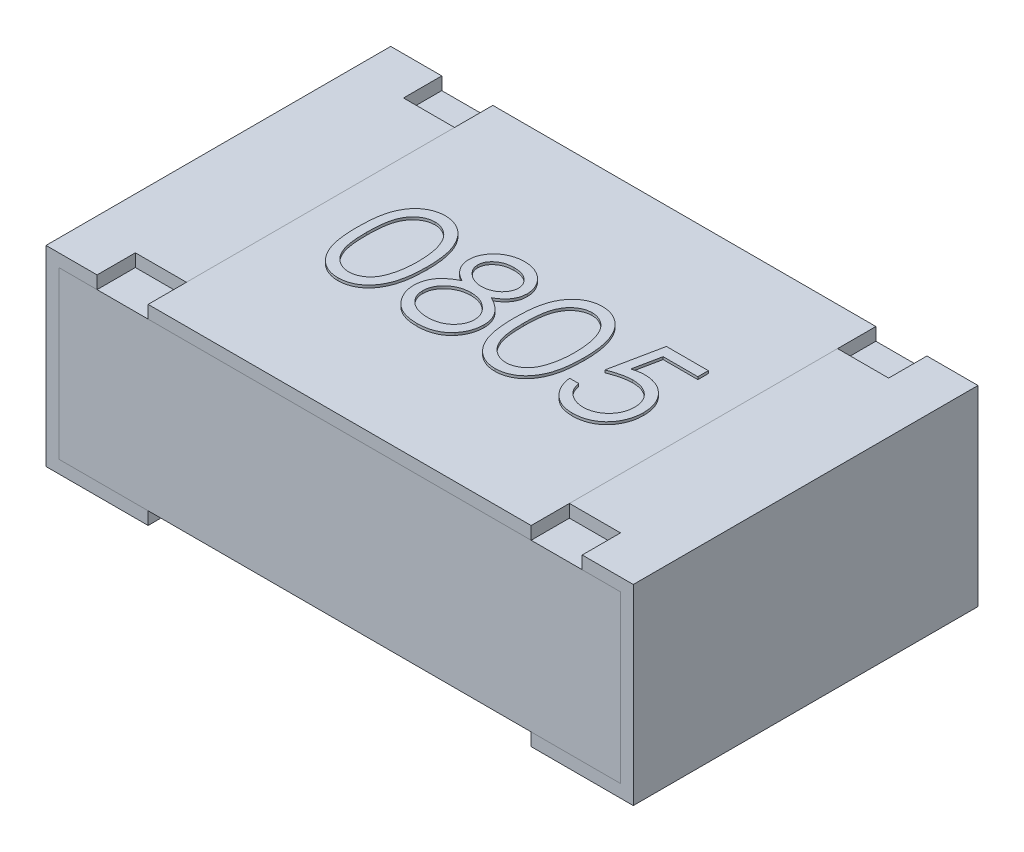
from build123d import *

# Parameters (mm, degrees)
CROQUIS1_W          = 2.2
CROQUIS1_H          = 1.35
EXTRUIR1_DEPTH      = 0.7
CROQUIS2_W          = 2.2
CROQUIS2_H          = 0.05
EXTRUIR2_DEPTH      = 2.876832438
CROQUIS4_W          = 1.35
CROQUIS4_H          = 0.05
EXTRUIR3_DEPTH      = 1.5
CROQUIS5_W          = 0.2
CROQUIS5_H          = 0.15
EXTRUIR4_DEPTH      = 0.05
BOSS_EXTRUDE1_DEPTH = 0.01


with BuildPart() as part:
    # Croquis1 → Extruir1 (new body)
    with BuildSketch(Plane(origin=(0, 0, 0), x_dir=(1, 0, 0), z_dir=(0, 1, 0))):
        Rectangle(CROQUIS1_W, CROQUIS1_H)
    extrude(amount=EXTRUIR1_DEPTH)

    # Croquis2 → Extruir2 (cut, through all)
    with BuildSketch(Plane.XY.offset(0.675)):
        with Locations((0, 0.025)):
            Rectangle(CROQUIS2_W, CROQUIS2_H)
    extrude(amount=-EXTRUIR2_DEPTH, mode=Mode.SUBTRACT)


with BuildPart() as body_2:
    # Barrer1: sweep along a path in Croquis3
    with BuildLine(Plane.XY.offset(0.675)) as barrer1_path:
        Line((-0.75, 0.75), (-1.15, 0.75))
        Line((-1.15, 0.75), (-1.15, 0))
        Line((-1.15, 0), (-0.75, 0))
    # Croquis3D1 → Barrer1 (sweep)
    with BuildSketch(Plane(origin=(-0.75, 0.75, 0.675), x_dir=(0, -0.0370116605098802, -0.9993148337667672), z_dir=(-1, 0, 0))):
        Polygon((0, 0), (1.349075026, -0.049965742), (1.350925609, 0), (0.001850583, 0.049965742), align=None)
    sweep(path=barrer1_path.line, transition=Transition.RIGHT)


with BuildPart() as body_3:
    # Simetría1: mirrored copy
    add(body_2.part.mirror(Plane(origin=(0, 0.7, 0.675), x_dir=(0, 0, 1), z_dir=(1, 0, 0))))


with BuildPart() as body_4:
    # Croquis4 → Extruir3 (new body)
    with BuildSketch(Plane(origin=(-0.75, 0, 0), x_dir=(0, 0, -1), z_dir=(1, 0, 0))):
        with Locations((0, 0.725)):
            Rectangle(CROQUIS4_W, CROQUIS4_H)
    extrude(amount=EXTRUIR3_DEPTH)

    # Sketch1 → Boss-Extrude1 (add)
    # profile 1 of 4: a face of its own
    with BuildSketch(Plane(origin=(0, 0.75, 0), x_dir=(1, 0, 0), z_dir=(0, 1, 0))):
        with BuildLine():
            add(Edge.make_bspline(
                [(-0.59261561, -0.012986983), (-0.592578122, -0.006575853), (-0.592505301, 0.005877859), (-0.591695196, 0.024024675), (-0.590349443, 0.041048708), (-0.588505172, 0.056950773), (-0.586260831, 0.071734975), (-0.583264775, 0.085361804), (-0.579857598, 0.097894331), (-0.575908747, 0.109373422), (-0.571453, 0.119953731), (-0.56660337, 0.129830897), (-0.561167393, 0.138989975), (-0.555455746, 0.147577151), (-0.549237224, 0.155451859), (-0.542688791, 0.162725306), (-0.535554862, 0.169229392), (-0.528077947, 0.175154683), (-0.520190351, 0.180348909), (-0.512116903, 0.184924079), (-0.503802034, 0.188832635), (-0.495223042, 0.191905828), (-0.486457035, 0.19444421), (-0.47747337, 0.19618009), (-0.468257214, 0.197272308), (-0.462036479, 0.197376727), (-0.458881635, 0.197429683)],
                knots=[0, 0, 0, 0, 1.646270934, 3.197905019, 4.663502075, 6.030701355, 7.308322542, 8.50163776, 9.611534131, 10.641858119, 11.616356847, 12.558055219, 13.465016945, 14.349605745, 15.204443733, 16.039544428, 16.859896111, 17.680448484, 18.487036065, 19.28249412, 20.06191084, 20.843045899, 21.620316918, 22.403196591, 23.190181807, 24, 24, 24, 24], degree=3))
            add(Edge.make_bspline(
                [(-0.458881635, 0.197429683), (-0.455700438, 0.197373933), (-0.449374037, 0.197263063), (-0.440020851, 0.19619747), (-0.430883745, 0.194429341), (-0.422001672, 0.191924087), (-0.413301673, 0.18881601), (-0.404851798, 0.184920339), (-0.39659956, 0.180385612), (-0.388676099, 0.175057168), (-0.380994428, 0.169116337), (-0.373743233, 0.162400603), (-0.366921851, 0.154977778), (-0.360444674, 0.146927279), (-0.354495463, 0.138094698), (-0.348829927, 0.128633657), (-0.343758838, 0.118378701), (-0.338874875, 0.107500934), (-0.334659219, 0.095699372), (-0.330857363, 0.083040543), (-0.32778548, 0.069374921), (-0.325226706, 0.054774208), (-0.323244433, 0.039184781), (-0.321800702, 0.022640059), (-0.321038064, 0.005129157), (-0.320894441, -0.006843168), (-0.320820738, -0.012986983)],
                knots=[0, 0, 0, 0, 0.810914788, 1.612654377, 2.396697861, 3.181598691, 3.963628158, 4.749916497, 5.551656086, 6.361998678, 7.18212741, 8.025565596, 8.878627764, 9.750805457, 10.657531673, 11.591944965, 12.560506719, 13.57287815, 14.630710178, 15.753379473, 16.941251878, 18.199788006, 19.531962791, 20.947069417, 22.433333509, 24, 24, 24, 24], degree=3))
            add(Edge.make_bspline(
                [(-0.320820738, -0.012986983), (-0.320895205, -0.019104001), (-0.3210403, -0.031022762), (-0.321792153, -0.048454873), (-0.323273139, -0.064911792), (-0.325125709, -0.080432988), (-0.327691533, -0.094953859), (-0.33084641, -0.108524653), (-0.334349304, -0.121203975), (-0.33867328, -0.132887954), (-0.343405933, -0.143739579), (-0.348555098, -0.153872968), (-0.35407165, -0.163377687), (-0.360081792, -0.172177658), (-0.366487896, -0.180335219), (-0.373427072, -0.187706376), (-0.38070371, -0.194468738), (-0.388407986, -0.200486067), (-0.396455021, -0.205752902), (-0.404678915, -0.210463056), (-0.413225588, -0.214261078), (-0.421901354, -0.217522226), (-0.43083031, -0.220013706), (-0.440001326, -0.221736433), (-0.449367753, -0.222944644), (-0.45569936, -0.223036813), (-0.458881635, -0.223083137)],
                knots=[0, 0, 0, 0, 1.561518951, 3.042555995, 4.452378317, 5.7783523, 7.031515105, 8.214008947, 9.334062868, 10.386615937, 11.391082383, 12.354592575, 13.286541444, 14.194233754, 15.072674879, 15.931287219, 16.775624067, 17.606195743, 18.42308326, 19.229000347, 20.022332153, 20.807536673, 21.593273796, 22.3848459, 23.188221202, 24, 24, 24, 24], degree=3))
            add(Edge.make_bspline(
                [(-0.458881635, -0.223083137), (-0.462036391, -0.22302984), (-0.468256954, -0.222924747), (-0.477474374, -0.221837463), (-0.486420939, -0.220089406), (-0.495140797, -0.217641794), (-0.503678684, -0.214645812), (-0.51191826, -0.210742534), (-0.519951138, -0.206247212), (-0.527755887, -0.201127735), (-0.535185849, -0.1952624), (-0.542282832, -0.188775053), (-0.548868548, -0.181503806), (-0.554998159, -0.173563472), (-0.560823769, -0.165027101), (-0.566182555, -0.155778144), (-0.571139224, -0.145853275), (-0.575669909, -0.135188371), (-0.579686899, -0.123627807), (-0.583235208, -0.11103933), (-0.586036826, -0.097311829), (-0.588434878, -0.082555558), (-0.590369094, -0.066707109), (-0.591689588, -0.049757877), (-0.592505738, -0.031718425), (-0.592578318, -0.019344736), (-0.59261561, -0.012986983)],
                knots=[0, 0, 0, 0, 0.810891512, 1.598919785, 2.382837074, 3.152667961, 3.926044502, 4.706494248, 5.493654104, 6.291793342, 7.103789334, 7.925228297, 8.761435821, 9.622817696, 10.50288917, 11.416980706, 12.369136599, 13.353924996, 14.394355917, 15.514179734, 16.714354668, 17.994756427, 19.357759367, 20.818452758, 22.365282078, 24, 24, 24, 24], degree=3))
        make_face()
        with BuildLine():
            add(Edge.make_bspline(
                [(-0.556718174, -0.012826727), (-0.556704523, -0.018169435), (-0.556678029, -0.028538583), (-0.555985892, -0.043606385), (-0.555043008, -0.057660137), (-0.55382686, -0.070717684), (-0.552020808, -0.082734828), (-0.549997175, -0.09379422), (-0.547534537, -0.103837333), (-0.54462082, -0.112933083), (-0.541302066, -0.121235834), (-0.537678539, -0.128961687), (-0.533785885, -0.136201908), (-0.529429411, -0.142891463), (-0.524684832, -0.149052168), (-0.519659317, -0.154793063), (-0.514165307, -0.159912718), (-0.506564879, -0.16605293), (-0.496530997, -0.172397974), (-0.483888659, -0.177923241), (-0.470897979, -0.181395522), (-0.462080693, -0.181837094), (-0.457679712, -0.182057496)],
                knots=[0, 0, 0, 0, 1.459021318, 2.831673884, 4.118529203, 5.306027144, 6.411944654, 7.436330062, 8.375795394, 9.233974572, 10.042671642, 10.816086306, 11.563610507, 12.285937304, 12.993564865, 13.685989202, 14.367179055, 15.041617293, 16.353048772, 17.594441528, 18.799311195, 20, 20, 20, 20], degree=3))
            add(Edge.make_bspline(
                [(-0.457679712, -0.182057496), (-0.453250264, -0.181874893), (-0.444400513, -0.181510063), (-0.431470936, -0.177990207), (-0.418918906, -0.172679402), (-0.409082112, -0.166399688), (-0.401598393, -0.160419307), (-0.396236451, -0.15532049), (-0.391315074, -0.149611248), (-0.386647409, -0.143451329), (-0.382366371, -0.136723045), (-0.378473441, -0.12945875), (-0.374921059, -0.121638273), (-0.372897168, -0.116178874), (-0.371862405, -0.113387624)],
                knots=[0, 0, 0, 0, 1.353760809, 2.704726607, 4.075137775, 5.516104923, 6.260822281, 7.007110065, 7.778089737, 8.566572457, 9.372053459, 10.217411131, 11.088608312, 12, 12, 12, 12], degree=3))
            add(Edge.make_bspline(
                [(-0.371862405, -0.113387624), (-0.370656488, -0.109818511), (-0.368207961, -0.102571681), (-0.36505233, -0.091330121), (-0.362567141, -0.079535519), (-0.360331328, -0.067258363), (-0.358805265, -0.054408112), (-0.357576943, -0.041024525), (-0.356853436, -0.027097512), (-0.35676375, -0.017635227), (-0.356718174, -0.012826727)],
                knots=[0, 0, 0, 0, 0.884706709, 1.796334032, 2.740027952, 3.714592787, 4.726048262, 5.777819803, 6.87074269, 8, 8, 8, 8], degree=3))
            add(Edge.make_bspline(
                [(-0.356718174, -0.012826727), (-0.356781053, -0.008019004), (-0.356904057, 0.001385929), (-0.357374227, 0.015159435), (-0.35858835, 0.028241465), (-0.359936821, 0.040688376), (-0.361925074, 0.052431268), (-0.364068824, 0.063568445), (-0.366948962, 0.073961934), (-0.370025508, 0.083774458), (-0.373546696, 0.092894532), (-0.37742278, 0.101364679), (-0.38156241, 0.109225791), (-0.386058666, 0.116456298), (-0.390858172, 0.123088589), (-0.396087606, 0.128989686), (-0.401539535, 0.134342482), (-0.409175785, 0.14045249), (-0.419172846, 0.146682398), (-0.431612349, 0.152415628), (-0.444557565, 0.155708004), (-0.453308817, 0.156172197), (-0.457679712, 0.156404042)],
                knots=[0, 0, 0, 0, 1.31362396, 2.569729283, 3.763502607, 4.902122613, 5.988968491, 7.01645872, 7.998833611, 8.933434873, 9.825090667, 10.667526885, 11.477055099, 12.250526234, 12.991942729, 13.710640831, 14.402115721, 15.076753259, 16.378508321, 17.609869233, 18.806226677, 20, 20, 20, 20], degree=3))
            add(Edge.make_bspline(
                [(-0.457679712, 0.156404042), (-0.46210378, 0.156171877), (-0.470959975, 0.155707123), (-0.484039741, 0.152427894), (-0.496577381, 0.146712127), (-0.506548007, 0.140431856), (-0.514189583, 0.134450334), (-0.519570462, 0.129263311), (-0.524615739, 0.123589453), (-0.529263476, 0.117372092), (-0.533616537, 0.110690335), (-0.537614367, 0.103491619), (-0.541216347, 0.095739463), (-0.544540294, 0.087440442), (-0.547462899, 0.078345477), (-0.549873637, 0.068314735), (-0.552100729, 0.057290519), (-0.553677331, 0.045208289), (-0.555078903, 0.032147472), (-0.555979629, 0.018058636), (-0.556680344, 0.002965563), (-0.556705311, -0.007457197), (-0.556718174, -0.012826727)],
                knots=[0, 0, 0, 0, 1.207732386, 2.417664972, 3.655092373, 4.956220595, 5.625982001, 6.301752483, 6.994047911, 7.697131622, 8.419323945, 9.170223765, 9.943494443, 10.752040957, 11.610060368, 12.549350801, 13.567764191, 14.679664412, 15.874934091, 17.154273443, 18.533957287, 20, 20, 20, 20], degree=3))
        make_face(mode=Mode.SUBTRACT)
    # profile 2 of 4: a face of its own
    with BuildSketch(Plane(origin=(0, 0.75, 0), x_dir=(1, 0, 0), z_dir=(0, 1, 0))):
        with BuildLine():
            add(Edge.make_bspline(
                [(-0.090452148, 0.010009811), (-0.087178029, 0.008302616), (-0.080792402, 0.004973016), (-0.071697864, -0.000388221), (-0.063386435, -0.006038617), (-0.055627514, -0.011711287), (-0.048557416, -0.017623476), (-0.042255198, -0.023798694), (-0.036565184, -0.030082802), (-0.031602123, -0.036582212), (-0.02723677, -0.043279657), (-0.023463955, -0.050192717), (-0.020239132, -0.057306241), (-0.017683367, -0.064697879), (-0.01557802, -0.072259052), (-0.014129379, -0.080087392), (-0.013350303, -0.088131317), (-0.01320301, -0.093567694), (-0.01312843, -0.096320317)],
                knots=[0, 0, 0, 0, 1.272397273, 2.481599622, 3.635517121, 4.734568067, 5.792894095, 6.808321871, 7.773003508, 8.711915296, 9.623354172, 10.525449501, 11.423591555, 12.311487226, 13.218079475, 14.126165749, 15.051214107, 16, 16, 16, 16], degree=3))
            add(Edge.make_bspline(
                [(-0.01312843, -0.096320317), (-0.013216593, -0.100171486), (-0.013391099, -0.107794396), (-0.014911097, -0.11904538), (-0.017186866, -0.129972441), (-0.020510239, -0.140573182), (-0.024820341, -0.150789111), (-0.030131979, -0.160628971), (-0.036144688, -0.170254034), (-0.040973516, -0.176176252), (-0.043416892, -0.179172881)],
                knots=[0, 0, 0, 0, 1.025265484, 2.029385089, 3.018602448, 3.995076438, 4.983346944, 5.966715145, 6.97116228, 8, 8, 8, 8], degree=3))
            add(Edge.make_bspline(
                [(-0.043416892, -0.179172881), (-0.046598203, -0.182669312), (-0.052921514, -0.189618969), (-0.063753848, -0.198641918), (-0.075642063, -0.206224706), (-0.088540159, -0.212404351), (-0.102413656, -0.217214164), (-0.117259599, -0.220670451), (-0.133106931, -0.222650158), (-0.143998985, -0.222936328), (-0.149586764, -0.223083137)],
                knots=[0, 0, 0, 0, 0.954267603, 1.896743057, 2.838368354, 3.796610408, 4.779680527, 5.799409237, 6.871065594, 8, 8, 8, 8], degree=3))
            add(Edge.make_bspline(
                [(-0.149586764, -0.223083137), (-0.154959722, -0.222951426), (-0.165414954, -0.222695128), (-0.180632997, -0.220958621), (-0.194818491, -0.217915437), (-0.208053916, -0.213750338), (-0.220259481, -0.208332027), (-0.231400407, -0.201588208), (-0.241637432, -0.193790329), (-0.250659886, -0.184714435), (-0.258669994, -0.174993535), (-0.265706343, -0.16496478), (-0.271554809, -0.154627253), (-0.276506477, -0.144135097), (-0.280297108, -0.133341251), (-0.282922504, -0.122301249), (-0.284589854, -0.111034376), (-0.284811698, -0.103430758), (-0.284923302, -0.099605573)],
                knots=[0, 0, 0, 0, 1.256902934, 2.445805442, 3.576955095, 4.645999104, 5.686449165, 6.692658513, 7.68621702, 8.689161843, 9.678783111, 10.630372946, 11.551080876, 12.453998257, 13.34127905, 14.221779781, 15.105423033, 16, 16, 16, 16], degree=3))
            add(Edge.make_bspline(
                [(-0.284923302, -0.099605573), (-0.284857259, -0.096798808), (-0.284726733, -0.09125165), (-0.283823322, -0.083056299), (-0.282370926, -0.075079598), (-0.280398417, -0.067292084), (-0.277725157, -0.059750453), (-0.274497485, -0.05241897), (-0.270733833, -0.045289359), (-0.2663817, -0.03832263), (-0.261318611, -0.0316164), (-0.255585623, -0.025056857), (-0.249068152, -0.018745787), (-0.241838705, -0.012606081), (-0.233979901, -0.006528827), (-0.225287612, -0.000842458), (-0.215992267, 0.004855595), (-0.209385935, 0.008262261), (-0.20599702, 0.010009811)],
                knots=[0, 0, 0, 0, 0.941657376, 1.861047343, 2.762797495, 3.66048619, 4.553285746, 5.444104102, 6.34607688, 7.256116206, 8.197091036, 9.162375105, 10.176350973, 11.237807142, 12.343728897, 13.50695164, 14.721116704, 16, 16, 16, 16], degree=3))
            add(Edge.make_bspline(
                [(-0.20599702, 0.010009811), (-0.210636034, 0.012539499), (-0.219618464, 0.017437683), (-0.231512115, 0.026437318), (-0.241728186, 0.036184497), (-0.249985868, 0.046885045), (-0.256485551, 0.058204688), (-0.26094482, 0.070072602), (-0.263961561, 0.082268729), (-0.264260399, 0.090600866), (-0.264410482, 0.094785452)],
                knots=[0, 0, 0, 0, 1.166880483, 2.259407225, 3.286803203, 4.280235371, 5.237608625, 6.161067461, 7.076446754, 8, 8, 8, 8], degree=3))
            add(Edge.make_bspline(
                [(-0.264410482, 0.094785452), (-0.264223576, 0.099048031), (-0.263847863, 0.107616556), (-0.260809769, 0.120371541), (-0.255858905, 0.132899149), (-0.249125076, 0.145138659), (-0.240737966, 0.156675826), (-0.230675504, 0.167023363), (-0.219177984, 0.176087532), (-0.206302799, 0.183696238), (-0.192447229, 0.189888656), (-0.177828289, 0.194160476), (-0.16270069, 0.196953175), (-0.152403808, 0.197269364), (-0.147182918, 0.197429683)],
                knots=[0, 0, 0, 0, 0.888701115, 1.786444228, 2.72001202, 3.692817113, 4.693886446, 5.687152267, 6.695133018, 7.739871481, 8.800368666, 9.853104506, 10.91144658, 12, 12, 12, 12], degree=3))
            add(Edge.make_bspline(
                [(-0.147182918, 0.197429683), (-0.142096767, 0.197264387), (-0.132067458, 0.196938441), (-0.117325215, 0.194219941), (-0.103219515, 0.189679424), (-0.089799001, 0.183519742), (-0.07730393, 0.175932663), (-0.066263666, 0.166743991), (-0.056511371, 0.1564421), (-0.048444583, 0.144908431), (-0.041797396, 0.132715952), (-0.037168721, 0.119959092), (-0.034202782, 0.106913485), (-0.033828683, 0.098086285), (-0.033641251, 0.093663658)],
                knots=[0, 0, 0, 0, 1.072916533, 2.115669174, 3.151510826, 4.193348718, 5.225979165, 6.227137561, 7.216255879, 8.211077061, 9.189680878, 10.138522389, 11.067357538, 12, 12, 12, 12], degree=3))
            add(Edge.make_bspline(
                [(-0.033641251, 0.093663658), (-0.033805201, 0.089323467), (-0.034127189, 0.080799581), (-0.036835753, 0.068373693), (-0.041397275, 0.056736888), (-0.047625179, 0.045757122), (-0.055742378, 0.035633522), (-0.065640519, 0.026237354), (-0.077240688, 0.017491431), (-0.085956217, 0.012555847), (-0.090452148, 0.010009811)],
                knots=[0, 0, 0, 0, 0.975232327, 1.915300861, 2.843280834, 3.77672583, 4.742871857, 5.749627742, 6.839139064, 8, 8, 8, 8], degree=3))
        make_face()
        with BuildLine():
            add(Edge.make_bspline(
                [(-0.149186123, 0.156404042), (-0.151991929, 0.156329592), (-0.157481313, 0.156183934), (-0.165530304, 0.155422947), (-0.173184289, 0.15394258), (-0.180523238, 0.151972441), (-0.18744653, 0.149310957), (-0.194048194, 0.146180099), (-0.200215873, 0.142373691), (-0.206024022, 0.13810384), (-0.211252682, 0.133407508), (-0.215893202, 0.128514511), (-0.219747843, 0.123328752), (-0.223021113, 0.117979226), (-0.225396144, 0.11230716), (-0.227174921, 0.106486454), (-0.228377366, 0.100443553), (-0.228467468, 0.096313666), (-0.228513046, 0.094224555)],
                knots=[0, 0, 0, 0, 1.203892937, 2.355340988, 3.463153438, 4.544400666, 5.610487187, 6.640501085, 7.674077295, 8.714426146, 9.728707835, 10.68524104, 11.601827946, 12.495867327, 13.368432065, 14.231010473, 15.105153427, 16, 16, 16, 16], degree=3))
            add(Edge.make_bspline(
                [(-0.228513046, 0.094224555), (-0.22843449, 0.092135354), (-0.228279251, 0.088006792), (-0.227078665, 0.081910122), (-0.22528931, 0.075919078), (-0.222472092, 0.070176117), (-0.219093079, 0.064482018), (-0.214922625, 0.058979094), (-0.20995245, 0.053648193), (-0.204349314, 0.048534657), (-0.198245139, 0.043746227), (-0.191778391, 0.039589292), (-0.185030232, 0.036111108), (-0.178069995, 0.033216319), (-0.170826744, 0.03096604), (-0.163344862, 0.029369623), (-0.15562309, 0.028377395), (-0.150391023, 0.028258879), (-0.147743815, 0.028198914)],
                knots=[0, 0, 0, 0, 0.873023192, 1.725219244, 2.590779336, 3.480155217, 4.391973325, 5.357036234, 6.360879153, 7.436073238, 8.526419356, 9.601555421, 10.645666583, 11.697338044, 12.750135903, 13.812665442, 14.89329948, 16, 16, 16, 16], degree=3))
            add(Edge.make_bspline(
                [(-0.147743815, 0.028198914), (-0.144343803, 0.02829867), (-0.137577361, 0.028497197), (-0.12760258, 0.030343046), (-0.117903992, 0.033246579), (-0.10858526, 0.037219147), (-0.099887594, 0.042205188), (-0.092134443, 0.048174676), (-0.085391941, 0.054989773), (-0.079730157, 0.062544382), (-0.07534046, 0.070584564), (-0.071923111, 0.078653169), (-0.069927543, 0.086836281), (-0.06966725, 0.09231822), (-0.069538687, 0.095025837)],
                knots=[0, 0, 0, 0, 1.076279235, 2.141928126, 3.20205304, 4.278698113, 5.344010996, 6.36967002, 7.368914609, 8.37248503, 9.349703398, 10.264243087, 11.142681841, 12, 12, 12, 12], degree=3))
            add(Edge.make_bspline(
                [(-0.069538687, 0.095025837), (-0.069599475, 0.096926184), (-0.069720131, 0.1006981), (-0.070714423, 0.106268199), (-0.072357376, 0.11171158), (-0.074581728, 0.117073211), (-0.077508561, 0.122277866), (-0.080978754, 0.127407362), (-0.085194126, 0.132346306), (-0.089925147, 0.137209798), (-0.095290336, 0.141710829), (-0.101279355, 0.145669082), (-0.107861498, 0.149030494), (-0.115036921, 0.151760637), (-0.122779198, 0.153811191), (-0.131052669, 0.155346774), (-0.13992632, 0.156212273), (-0.146032577, 0.156338733), (-0.149186123, 0.156404042)],
                knots=[0, 0, 0, 0, 0.814439003, 1.616544685, 2.417341072, 3.248991801, 4.09997495, 4.973547432, 5.9003056, 6.880240646, 7.880314356, 8.896779544, 9.951930927, 11.043077905, 12.18215768, 13.381699519, 14.647792085, 16, 16, 16, 16], degree=3))
        make_face(mode=Mode.SUBTRACT)
        with BuildLine():
            add(Edge.make_bspline(
                [(-0.146862405, -0.012826727), (-0.150419637, -0.01289), (-0.15739806, -0.013014127), (-0.167621709, -0.014395784), (-0.177433499, -0.016319143), (-0.186800349, -0.019236954), (-0.195718303, -0.023030838), (-0.204235638, -0.027594786), (-0.212287196, -0.032989693), (-0.219761793, -0.039147021), (-0.226587316, -0.045782387), (-0.232575693, -0.052806631), (-0.237661124, -0.060089206), (-0.241756353, -0.067722604), (-0.245117694, -0.075545188), (-0.247324994, -0.08375177), (-0.248740047, -0.092184583), (-0.248930062, -0.097917166), (-0.249025866, -0.100807496)],
                knots=[0, 0, 0, 0, 1.140299081, 2.23698856, 3.303958914, 4.344563908, 5.37730929, 6.408454204, 7.439741482, 8.480804886, 9.510774543, 10.48932336, 11.43758569, 12.353841022, 13.263987381, 14.161954604, 15.073269652, 16, 16, 16, 16], degree=3))
            add(Edge.make_bspline(
                [(-0.249025866, -0.100807496), (-0.248870065, -0.1043996), (-0.24856096, -0.111526249), (-0.246108772, -0.122059172), (-0.242173283, -0.132255864), (-0.236684687, -0.14203323), (-0.229888393, -0.151170385), (-0.221531082, -0.159134816), (-0.212132129, -0.166211557), (-0.201373517, -0.171935046), (-0.189621692, -0.176505887), (-0.176879781, -0.17965514), (-0.163330647, -0.181739877), (-0.153975265, -0.181949955), (-0.149186123, -0.182057496)],
                knots=[0, 0, 0, 0, 0.898778495, 1.783155532, 2.693654817, 3.627872908, 4.583023416, 5.533784346, 6.509005473, 7.520592997, 8.575161974, 9.658835044, 10.801527049, 12, 12, 12, 12], degree=3))
            add(Edge.make_bspline(
                [(-0.149186123, -0.182057496), (-0.145443223, -0.181985632), (-0.138150856, -0.181845619), (-0.127512461, -0.180609699), (-0.117473084, -0.178649742), (-0.108052193, -0.175799051), (-0.099144326, -0.172319054), (-0.090900514, -0.167842245), (-0.083108682, -0.162750551), (-0.076152782, -0.156709618), (-0.069817559, -0.150254819), (-0.064293754, -0.143421671), (-0.059498605, -0.136395885), (-0.055735067, -0.129018686), (-0.052726353, -0.12143161), (-0.050563661, -0.113564695), (-0.049229236, -0.105393811), (-0.049094276, -0.09985106), (-0.049025866, -0.097041471)],
                knots=[0, 0, 0, 0, 1.224942928, 2.386581632, 3.501229538, 4.569074225, 5.605009692, 6.626002462, 7.634866581, 8.645888296, 9.63523824, 10.59253846, 11.518950513, 12.414518923, 13.29783783, 14.186679152, 15.080837789, 16, 16, 16, 16], degree=3))
            add(Edge.make_bspline(
                [(-0.049025866, -0.097041471), (-0.049129392, -0.094312632), (-0.049333526, -0.088931838), (-0.050629148, -0.080958521), (-0.052905248, -0.073255342), (-0.056028379, -0.065729627), (-0.060186204, -0.058533861), (-0.06508276, -0.051480584), (-0.070990659, -0.044765562), (-0.077666385, -0.038336637), (-0.084941694, -0.032391981), (-0.092675082, -0.027133188), (-0.100807021, -0.022704375), (-0.109320302, -0.01910249), (-0.118196023, -0.016269636), (-0.127427655, -0.014290665), (-0.137026006, -0.013044996), (-0.143546563, -0.012900305), (-0.146862405, -0.012826727)],
                knots=[0, 0, 0, 0, 0.917430815, 1.809013306, 2.70690318, 3.612392954, 4.541220862, 5.495268465, 6.494511384, 7.542276156, 8.608045339, 9.649016899, 10.681629292, 11.715607085, 12.752076957, 13.808767841, 14.885711793, 16, 16, 16, 16], degree=3))
        make_face(mode=Mode.SUBTRACT)
    # profile 3 of 4: a face of its own
    with BuildSketch(Plane(origin=(0, 0.75, 0), x_dir=(1, 0, 0), z_dir=(0, 1, 0))):
        with BuildLine():
            add(Edge.make_bspline(
                [(0.022769006, -0.012986983), (0.022806493, -0.006575853), (0.022879314, 0.005877859), (0.023689419, 0.024024675), (0.025035173, 0.041048708), (0.026879444, 0.056950773), (0.029123784, 0.071734975), (0.03211984, 0.085361804), (0.035527017, 0.097894331), (0.039475868, 0.109373422), (0.043931616, 0.119953731), (0.048781245, 0.129830897), (0.054217222, 0.138989975), (0.059928869, 0.147577151), (0.066147392, 0.155451859), (0.072695825, 0.162725306), (0.079829754, 0.169229392), (0.087306669, 0.175154683), (0.095194265, 0.180348909), (0.103267712, 0.184924079), (0.111582582, 0.188832635), (0.120161574, 0.191905828), (0.12892758, 0.19444421), (0.137911245, 0.19618009), (0.147127401, 0.197272308), (0.153348137, 0.197376727), (0.15650298, 0.197429683)],
                knots=[0, 0, 0, 0, 1.646270934, 3.197905019, 4.663502075, 6.030701355, 7.308322542, 8.50163776, 9.611534131, 10.641858119, 11.616356847, 12.558055219, 13.465016945, 14.349605745, 15.204443733, 16.039544428, 16.859896111, 17.680448484, 18.487036065, 19.28249412, 20.06191084, 20.843045899, 21.620316918, 22.403196591, 23.190181807, 24, 24, 24, 24], degree=3))
            add(Edge.make_bspline(
                [(0.15650298, 0.197429683), (0.159684177, 0.197373933), (0.166010578, 0.197263063), (0.175363764, 0.19619747), (0.184500871, 0.194429341), (0.193382944, 0.191924087), (0.202082942, 0.18881601), (0.210532817, 0.184920339), (0.218785055, 0.180385612), (0.226708517, 0.175057168), (0.234390187, 0.169116337), (0.241641383, 0.162400603), (0.248462764, 0.154977778), (0.254939942, 0.146927279), (0.260889153, 0.138094698), (0.266554688, 0.128633657), (0.271625778, 0.118378701), (0.276509741, 0.107500934), (0.280725396, 0.095699372), (0.284527253, 0.083040543), (0.287599135, 0.069374921), (0.290157909, 0.054774208), (0.292140183, 0.039184781), (0.293583913, 0.022640059), (0.294346552, 0.005129157), (0.294490175, -0.006843168), (0.294563877, -0.012986983)],
                knots=[0, 0, 0, 0, 0.810914788, 1.612654377, 2.396697861, 3.181598691, 3.963628158, 4.749916497, 5.551656086, 6.361998678, 7.18212741, 8.025565596, 8.878627764, 9.750805457, 10.657531673, 11.591944965, 12.560506719, 13.57287815, 14.630710178, 15.753379473, 16.941251878, 18.199788006, 19.531962791, 20.947069417, 22.433333509, 24, 24, 24, 24], degree=3))
            add(Edge.make_bspline(
                [(0.294563877, -0.012986983), (0.294489411, -0.019104001), (0.294344315, -0.031022762), (0.293592463, -0.048454873), (0.292111476, -0.064911792), (0.290258906, -0.080432988), (0.287693082, -0.094953859), (0.284538206, -0.108524653), (0.281035312, -0.121203975), (0.276711335, -0.132887954), (0.271978683, -0.143739579), (0.266829517, -0.153872968), (0.261312966, -0.163377687), (0.255302824, -0.172177658), (0.248896719, -0.180335219), (0.241957543, -0.187706376), (0.234680905, -0.194468738), (0.226976629, -0.200486067), (0.218929595, -0.205752902), (0.2107057, -0.210463056), (0.202159028, -0.214261078), (0.193483262, -0.217522226), (0.184554305, -0.220013706), (0.175383289, -0.221736433), (0.166016862, -0.222944644), (0.159685255, -0.223036813), (0.15650298, -0.223083137)],
                knots=[0, 0, 0, 0, 1.561518951, 3.042555995, 4.452378317, 5.7783523, 7.031515105, 8.214008947, 9.334062868, 10.386615937, 11.391082383, 12.354592575, 13.286541444, 14.194233754, 15.072674879, 15.931287219, 16.775624067, 17.606195743, 18.42308326, 19.229000347, 20.022332153, 20.807536673, 21.593273796, 22.3848459, 23.188221202, 24, 24, 24, 24], degree=3))
            add(Edge.make_bspline(
                [(0.15650298, -0.223083137), (0.153348224, -0.22302984), (0.147127661, -0.222924747), (0.137910241, -0.221837463), (0.128963676, -0.220089406), (0.120243819, -0.217641794), (0.111705931, -0.214645812), (0.103466356, -0.210742534), (0.095433477, -0.206247212), (0.087628728, -0.201127735), (0.080198767, -0.1952624), (0.073101783, -0.188775053), (0.066516067, -0.181503806), (0.060386456, -0.173563472), (0.054560846, -0.165027101), (0.04920206, -0.155778144), (0.044245391, -0.145853275), (0.039714707, -0.135188371), (0.035697717, -0.123627807), (0.032149407, -0.11103933), (0.029347789, -0.097311829), (0.026949737, -0.082555558), (0.025015522, -0.066707109), (0.023695028, -0.049757877), (0.022878877, -0.031718425), (0.022806298, -0.019344736), (0.022769006, -0.012986983)],
                knots=[0, 0, 0, 0, 0.810891512, 1.598919785, 2.382837074, 3.152667961, 3.926044502, 4.706494248, 5.493654104, 6.291793342, 7.103789334, 7.925228297, 8.761435821, 9.622817696, 10.50288917, 11.416980706, 12.369136599, 13.353924996, 14.394355917, 15.514179734, 16.714354668, 17.994756427, 19.357759367, 20.818452758, 22.365282078, 24, 24, 24, 24], degree=3))
        make_face()
        with BuildLine():
            add(Edge.make_bspline(
                [(0.058666441, -0.012826727), (0.058680093, -0.018169435), (0.058706587, -0.028538583), (0.059398724, -0.043606385), (0.060341608, -0.057660137), (0.061557756, -0.070717684), (0.063363807, -0.082734828), (0.06538744, -0.09379422), (0.067850079, -0.103837333), (0.070763795, -0.112933083), (0.074082549, -0.121235834), (0.077706076, -0.128961687), (0.08159873, -0.136201908), (0.085955205, -0.142891463), (0.090699783, -0.149052168), (0.095725299, -0.154793063), (0.101219308, -0.159912718), (0.108819736, -0.16605293), (0.118853619, -0.172397974), (0.131495957, -0.177923241), (0.144486637, -0.181395522), (0.153303922, -0.181837094), (0.157704903, -0.182057496)],
                knots=[0, 0, 0, 0, 1.459021318, 2.831673884, 4.118529203, 5.306027144, 6.411944654, 7.436330062, 8.375795394, 9.233974572, 10.042671642, 10.816086306, 11.563610507, 12.285937304, 12.993564865, 13.685989202, 14.367179055, 15.041617293, 16.353048772, 17.594441528, 18.799311195, 20, 20, 20, 20], degree=3))
            add(Edge.make_bspline(
                [(0.157704903, -0.182057496), (0.162134351, -0.181874893), (0.170984102, -0.181510063), (0.183913679, -0.177990207), (0.19646571, -0.172679402), (0.206302503, -0.166399688), (0.213786222, -0.160419307), (0.219148164, -0.15532049), (0.224069541, -0.149611248), (0.228737207, -0.143451329), (0.233018244, -0.136723045), (0.236911174, -0.12945875), (0.240463556, -0.121638273), (0.242487447, -0.116178874), (0.243522211, -0.113387624)],
                knots=[0, 0, 0, 0, 1.353760809, 2.704726607, 4.075137775, 5.516104923, 6.260822281, 7.007110065, 7.778089737, 8.566572457, 9.372053459, 10.217411131, 11.088608312, 12, 12, 12, 12], degree=3))
            add(Edge.make_bspline(
                [(0.243522211, -0.113387624), (0.244728127, -0.109818511), (0.247176654, -0.102571681), (0.250332286, -0.091330121), (0.252817474, -0.079535519), (0.255053287, -0.067258363), (0.256579351, -0.054408112), (0.257807672, -0.041024525), (0.258531179, -0.027097512), (0.258620865, -0.017635227), (0.258666441, -0.012826727)],
                knots=[0, 0, 0, 0, 0.884706709, 1.796334032, 2.740027952, 3.714592787, 4.726048262, 5.777819803, 6.87074269, 8, 8, 8, 8], degree=3))
            add(Edge.make_bspline(
                [(0.258666441, -0.012826727), (0.258603563, -0.008019004), (0.258480558, 0.001385929), (0.258010388, 0.015159435), (0.256796266, 0.028241465), (0.255447795, 0.040688376), (0.253459541, 0.052431268), (0.251315792, 0.063568445), (0.248435653, 0.073961934), (0.245359107, 0.083774458), (0.241837919, 0.092894532), (0.237961835, 0.101364679), (0.233822206, 0.109225791), (0.22932595, 0.116456298), (0.224526443, 0.123088589), (0.219297009, 0.128989686), (0.213845081, 0.134342482), (0.206208831, 0.14045249), (0.196211769, 0.146682398), (0.183772267, 0.152415628), (0.17082705, 0.155708004), (0.162075798, 0.156172197), (0.157704903, 0.156404042)],
                knots=[0, 0, 0, 0, 1.31362396, 2.569729283, 3.763502607, 4.902122613, 5.988968491, 7.01645872, 7.998833611, 8.933434873, 9.825090667, 10.667526885, 11.477055099, 12.250526234, 12.991942729, 13.710640831, 14.402115721, 15.076753259, 16.378508321, 17.609869233, 18.806226677, 20, 20, 20, 20], degree=3))
            add(Edge.make_bspline(
                [(0.157704903, 0.156404042), (0.153280835, 0.156171877), (0.14442464, 0.155707123), (0.131344874, 0.152427894), (0.118807234, 0.146712127), (0.108836608, 0.140431856), (0.101195033, 0.134450334), (0.095814153, 0.129263311), (0.090768877, 0.123589453), (0.086121139, 0.117372092), (0.081768079, 0.110690335), (0.077770249, 0.103491619), (0.074168268, 0.095739463), (0.070844321, 0.087440442), (0.067921717, 0.078345477), (0.065510978, 0.068314735), (0.063283886, 0.057290519), (0.061707284, 0.045208289), (0.060305712, 0.032147472), (0.059404986, 0.018058636), (0.058704271, 0.002965563), (0.058679304, -0.007457197), (0.058666441, -0.012826727)],
                knots=[0, 0, 0, 0, 1.207732386, 2.417664972, 3.655092373, 4.956220595, 5.625982001, 6.301752483, 6.994047911, 7.697131622, 8.419323945, 9.170223765, 9.943494443, 10.752040957, 11.610060368, 12.549350801, 13.567764191, 14.679664412, 15.874934091, 17.154273443, 18.533957287, 20, 20, 20, 20], degree=3))
        make_face(mode=Mode.SUBTRACT)
    # profile 4 of 4: a face of its own
    with BuildSketch(Plane(origin=(0, 0.75, 0), x_dir=(1, 0, 0), z_dir=(0, 1, 0))):
        with BuildLine():
            Line((0.581743365, 0.187173273), (0.581743365, 0.146147632))
            Line((0.581743365, 0.146147632), (0.445685672, 0.146147632))
            Line((0.445685672, 0.146147632), (0.424131185, 0.040939299))
            add(Edge.make_bspline(
                [(0.424131185, 0.040939299), (0.428366142, 0.042108473), (0.436570702, 0.044373562), (0.4486804, 0.046888507), (0.460176652, 0.048404558), (0.467636694, 0.048611565), (0.47124657, 0.048711735)],
                knots=[0, 0, 0, 0, 1.100273476, 2.13160584, 3.095893838, 4, 4, 4, 4], degree=3))
            add(Edge.make_bspline(
                [(0.47124657, 0.048711735), (0.475713283, 0.048615056), (0.484495957, 0.048424962), (0.497346122, 0.046599608), (0.509612738, 0.043726475), (0.521270152, 0.039712701), (0.532339929, 0.03458016), (0.542720222, 0.028168738), (0.552566841, 0.020679215), (0.561703137, 0.012068356), (0.56999163, 0.0025916), (0.577279171, -0.007597871), (0.583469182, -0.018401032), (0.588447554, -0.029921102), (0.592422906, -0.042030719), (0.595068848, -0.0548573), (0.596830758, -0.068279942), (0.597027602, -0.077457608), (0.59712798, -0.082137624)],
                knots=[0, 0, 0, 0, 1.052922333, 2.070308379, 3.05430497, 4.020497103, 4.973039431, 5.925935799, 6.892292201, 7.88610001, 8.88166317, 9.857072816, 10.836096531, 11.812156883, 12.81219415, 13.836441305, 14.89672472, 16, 16, 16, 16], degree=3))
            add(Edge.make_bspline(
                [(0.59712798, -0.082137624), (0.597051971, -0.085397307), (0.596900981, -0.09187262), (0.596133143, -0.1014891), (0.594654775, -0.110901995), (0.592669892, -0.120112554), (0.590093616, -0.129103339), (0.586974867, -0.137900085), (0.583158178, -0.146448041), (0.578971735, -0.154828086), (0.574257852, -0.162850772), (0.569026023, -0.170353514), (0.563498538, -0.17744886), (0.557550951, -0.184060715), (0.55112798, -0.190145631), (0.544307413, -0.195739721), (0.537143673, -0.200937587), (0.529525931, -0.205528238), (0.521623933, -0.209752576), (0.513323566, -0.213218123), (0.504813771, -0.216316469), (0.495972071, -0.218786129), (0.486818493, -0.220721278), (0.477337947, -0.222035633), (0.467580156, -0.22299294), (0.460965869, -0.223052866), (0.457624775, -0.223083137)],
                knots=[0, 0, 0, 0, 1.056347294, 2.098418968, 3.122841568, 4.141288669, 5.149314143, 6.15115421, 7.162517403, 8.180376062, 9.185164535, 10.17417709, 11.141909838, 12.097768115, 13.052685741, 14.0056014, 14.954263652, 15.917497458, 16.885230207, 17.854509472, 18.828990115, 19.81800267, 20.826176721, 21.857883937, 22.917946725, 24, 24, 24, 24], degree=3))
            add(Edge.make_bspline(
                [(0.457624775, -0.223083137), (0.453639154, -0.223004184), (0.445797916, -0.222848854), (0.434309852, -0.221223884), (0.423256754, -0.218896579), (0.412727599, -0.215395291), (0.402628026, -0.211008172), (0.393094001, -0.205463467), (0.383881913, -0.199180141), (0.375366251, -0.191765243), (0.367462696, -0.183660594), (0.360387666, -0.174865435), (0.354086686, -0.165524927), (0.348660658, -0.155593709), (0.344032312, -0.145097877), (0.340396314, -0.133998106), (0.337461644, -0.122352391), (0.336220111, -0.114334847), (0.335589518, -0.110262624)],
                knots=[0, 0, 0, 0, 1.0467383, 2.05933395, 3.04377827, 4.011590433, 4.970194871, 5.932262533, 6.905835911, 7.896367577, 8.894135286, 9.877477877, 10.858688626, 11.851381753, 12.8477658, 13.868841284, 14.917554742, 16, 16, 16, 16], degree=3))
            Line((0.335589518, -0.110262624), (0.371486954, -0.110262624))
            add(Edge.make_bspline(
                [(0.371486954, -0.110262624), (0.372370218, -0.114077076), (0.3740679, -0.121408664), (0.377794271, -0.131709389), (0.382350371, -0.140888729), (0.387768011, -0.14906811), (0.394230872, -0.156200567), (0.401605664, -0.162556802), (0.409873975, -0.168291103), (0.419061772, -0.173070847), (0.428754696, -0.177147276), (0.43889952, -0.179861756), (0.449220016, -0.181770429), (0.456200402, -0.181961488), (0.459708108, -0.182057496)],
                knots=[0, 0, 0, 0, 1.136247022, 2.183929868, 3.172523383, 4.106158343, 5.02341133, 5.958108904, 6.928429099, 7.938127109, 8.96079061, 9.975095812, 10.982467395, 12, 12, 12, 12], degree=3))
            add(Edge.make_bspline(
                [(0.459708108, -0.182057496), (0.46313193, -0.181963693), (0.469873464, -0.181778994), (0.479794766, -0.180357392), (0.48937338, -0.178167956), (0.498514792, -0.174891401), (0.507378968, -0.170909147), (0.515741685, -0.165798853), (0.523844871, -0.159917708), (0.531436657, -0.153179807), (0.538389737, -0.145754699), (0.544533294, -0.137814426), (0.549650655, -0.129343929), (0.553963125, -0.120489855), (0.557237788, -0.111155162), (0.5595739, -0.101383599), (0.560945678, -0.09115103), (0.561134384, -0.084171681), (0.561230544, -0.080615189)],
                knots=[0, 0, 0, 0, 1.027316725, 2.022795036, 3.002884548, 3.971462791, 4.93288096, 5.914575861, 6.907176829, 7.935150275, 8.956128384, 9.956726525, 10.942570165, 11.921478529, 12.907843606, 13.90538589, 14.932640048, 16, 16, 16, 16], degree=3))
            add(Edge.make_bspline(
                [(0.561230544, -0.080615189), (0.561155289, -0.077406531), (0.561007989, -0.071126041), (0.559804495, -0.06193756), (0.557711127, -0.053243498), (0.55480554, -0.045001872), (0.551116454, -0.037204907), (0.546608304, -0.029844557), (0.541196487, -0.023017833), (0.535014557, -0.016721541), (0.528242209, -0.010910699), (0.520762924, -0.005957089), (0.512733218, -0.001789784), (0.504249836, 0.001806559), (0.49511099, 0.004389501), (0.485497661, 0.006328688), (0.475306037, 0.007450444), (0.468337958, 0.007606088), (0.464756185, 0.007686093)],
                knots=[0, 0, 0, 0, 1.045622112, 2.046656509, 3.013763289, 3.955457236, 4.890082067, 5.820317437, 6.762574623, 7.722996705, 8.69280354, 9.665887285, 10.63943826, 11.638615906, 12.663482002, 13.728887084, 14.832589034, 16, 16, 16, 16], degree=3))
            add(Edge.make_bspline(
                [(0.464756185, 0.007686093), (0.461655736, 0.00761974), (0.455254095, 0.007482738), (0.445434344, 0.006473995), (0.43511529, 0.004846647), (0.42433649, 0.002608219), (0.413065575, -0.000321047), (0.401326329, -0.003831276), (0.38909407, -0.008028076), (0.380852045, -0.011197471), (0.376615159, -0.012826727)],
                knots=[0, 0, 0, 0, 0.817624296, 1.688186739, 2.600797293, 3.572016777, 4.590301741, 5.671205678, 6.80286297, 8, 8, 8, 8], degree=3))
            Line((0.376615159, -0.012826727), (0.4176408, 0.187173273))
            Line((0.4176408, 0.187173273), (0.581743365, 0.187173273))
        make_face()
    extrude(amount=BOSS_EXTRUDE1_DEPTH)


with BuildPart() as extruir4_tool:
    # Croquis5 → Extruir4 (new body)
    with BuildSketch(Plane(origin=(0, 0.75, 0), x_dir=(1, 0, 0), z_dir=(0, 1, 0))):
        with Locations((-0.85, -0.6)):
            Rectangle(CROQUIS5_W, CROQUIS5_H)
        with Locations((-0.85, 0.6)):
            Rectangle(CROQUIS5_W, CROQUIS5_H)
        with Locations((0.85, 0.6)):
            Rectangle(CROQUIS5_W, CROQUIS5_H)
        with Locations((0.85, -0.6)):
            Rectangle(CROQUIS5_W, CROQUIS5_H)
    extrude(amount=-EXTRUIR4_DEPTH)


with BuildPart() as body_2_1:
    add(body_2.part)

    # Extruir4: cut by extruir4_tool
    add(extruir4_tool.part, mode=Mode.SUBTRACT)


with BuildPart() as body_3_1:
    add(body_3.part)

    # Extruir4: cut by extruir4_tool
    add(extruir4_tool.part, mode=Mode.SUBTRACT)


solid = Compound([part.part, body_4.part, body_2_1.part, body_3_1.part])
